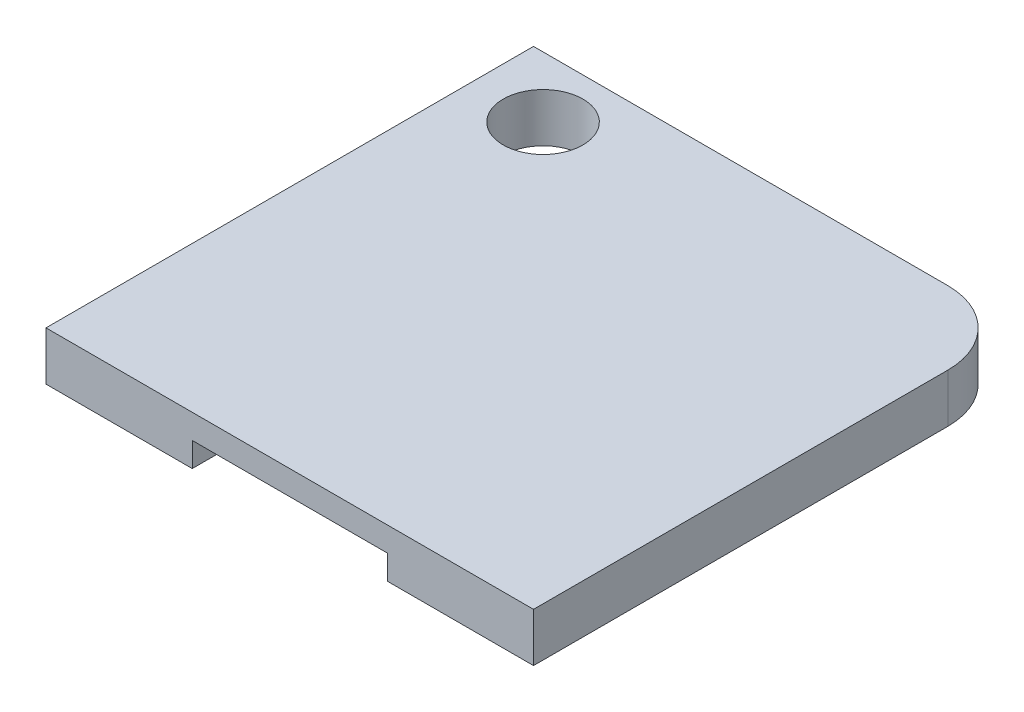
from build123d import *

# Parameters (mm, degrees)
BOSS_EXTRUDE1_DEPTH = 20
SKETCH5_R           = 16.335585921
CUT_EXTRUDE1_DEPTH  = 20
CUT_EXTRUDE2_DEPTH  = 10
SKETCH7_W           = 90
SKETCH7_H           = 3
CUT_EXTRUDE3_DEPTH  = 3
SKETCH9_W           = 110
SKETCH9_H           = 35
CUT_EXTRUDE4_DEPTH  = 8


with BuildPart() as part:
    # Sketch1 → Boss-Extrude1 (new body)
    with BuildSketch(Plane(origin=(0, 0, 0), x_dir=(1, 0, 0), z_dir=(0, 1, 0))):
        with BuildLine():
            Line((0, 0), (200, 0))
            Line((200, 0), (200, 170))
            ThreePointArc((200, 170), (191.213203436, 191.213203436), (170, 200))
            Line((170, 200), (0, 200))
            Line((0, 200), (0, 0))
        make_face()
    extrude(amount=BOSS_EXTRUDE1_DEPTH)

    # Sketch5 → Cut-Extrude1 (cut)
    with BuildSketch(Plane.XZ):
        with Locations(Location((28.826554305, -175.088684358, 0), (0, 0, 270))):
            Circle(SKETCH5_R)
    extrude(amount=-CUT_EXTRUDE1_DEPTH, mode=Mode.SUBTRACT)

    # Sketch6 → Cut-Extrude2 (cut)
    with BuildSketch(Plane(origin=(0, 0, 0), x_dir=(-1, 0, 0), z_dir=(0, -1, 0))):
        with BuildLine():
            Line((-60, 0), (-140, 0))
            Line((-140, 0), (-140, 20))
            Line((-140, 20), (-65, 20))
            ThreePointArc((-65, 20), (-61.464466094, 18.535533906), (-60, 15))
            Line((-60, 15), (-60, 0))
        make_face()
    extrude(amount=-CUT_EXTRUDE2_DEPTH, mode=Mode.SUBTRACT)

    # Sketch7 → Cut-Extrude3 (cut)
    # profile 1 of 10: a face of its own
    with BuildSketch(Plane.XZ):
        with Locations((100, -104.5)):
            Rectangle(SKETCH7_W, SKETCH7_H)
    # profile 2 of 10: a face of its own
    with BuildSketch(Plane.XZ):
        with BuildLine():
            Line((70.352564103, -92), (71.075320513, -92))
            Line((71.075320513, -92), (70.432692308, -96.59775641))
            add(Edge.make_bspline(
                [(70.432692308, -96.59775641), (70.422300824, -96.670908312), (70.402292258, -96.811760634), (70.377311776, -97.015446039), (70.354142014, -97.202276219), (70.336963803, -97.373331101), (70.321803165, -97.527624302), (70.312710928, -97.666607297), (70.305251131, -97.788915506), (70.304728318, -97.865375309), (70.304487179, -97.900641026)],
                knots=[0, 0, 0, 0, 1.353577231, 2.606282137, 3.759465843, 4.802401145, 5.755764954, 6.59944622, 7.354019609, 8, 8, 8, 8], degree=3))
            add(Edge.make_bspline(
                [(70.304487179, -97.900641026), (70.305299501, -97.962696148), (70.306873997, -98.082975525), (70.33102938, -98.257568792), (70.365092174, -98.421522608), (70.414859775, -98.574793111), (70.47967049, -98.717039292), (70.557584136, -98.849061406), (70.652362768, -98.968696914), (70.759326061, -99.077865638), (70.88024504, -99.174130519), (71.01320165, -99.257935991), (71.157185741, -99.330450263), (71.313933193, -99.387650685), (71.481762042, -99.432791589), (71.661435728, -99.464145703), (71.852661893, -99.483765472), (71.983924786, -99.486021706), (72.051282051, -99.487179487)],
                knots=[0, 0, 0, 0, 1.10852276, 2.148612763, 3.145170886, 4.099557541, 5.022755833, 5.93507125, 6.833026532, 7.744741873, 8.662042658, 9.589381315, 10.550387302, 11.538535113, 12.56716129, 13.653744098, 14.796023929, 16, 16, 16, 16], degree=3))
            add(Edge.make_bspline(
                [(72.051282051, -99.487179487), (72.145959891, -99.485326813), (72.330138076, -99.48172278), (72.597783016, -99.445074413), (72.849446414, -99.388454303), (73.084335239, -99.306509657), (73.300734302, -99.202347286), (73.499173635, -99.078396445), (73.67630564, -98.931205949), (73.833856312, -98.764212112), (73.969620277, -98.578514335), (74.087686435, -98.380316921), (74.181052375, -98.166518451), (74.226850784, -98.017586621), (74.25, -97.942307692)],
                knots=[0, 0, 0, 0, 1.169524916, 2.27509392, 3.332125827, 4.35318333, 5.342430969, 6.29492923, 7.237490507, 8.180953171, 9.125108624, 10.075132383, 11.027058416, 12, 12, 12, 12], degree=3))
            add(Edge.make_bspline(
                [(74.25, -97.942307692), (74.267958404, -97.872944619), (74.305015035, -97.729815982), (74.355679675, -97.507389154), (74.405194651, -97.271753501), (74.454021131, -97.023007981), (74.497384477, -96.760246223), (74.54345719, -96.484951509), (74.584413949, -96.196265157), (74.61022263, -95.999488792), (74.623397436, -95.899038462)],
                knots=[0, 0, 0, 0, 0.82726344, 1.707033479, 2.633662931, 3.607436325, 4.633615893, 5.708467267, 6.830219163, 8, 8, 8, 8], degree=3))
            Line((74.623397436, -95.899038462), (75.168269231, -92))
            Line((75.168269231, -92), (75.891025641, -92))
            Line((75.891025641, -92), (75.323717949, -96.0625))
            Line((75.323717949, -96.0625), (75.193910256, -97.048076923))
            add(Edge.make_bspline(
                [(75.193910256, -97.048076923), (75.175036258, -97.1588241), (75.138716049, -97.371940602), (75.071777048, -97.677863222), (75.002447084, -97.958781558), (74.927103259, -98.217090176), (74.84192865, -98.455133484), (74.744192203, -98.677018908), (74.633009808, -98.884691637), (74.510390103, -99.07855735), (74.375210994, -99.256026196), (74.233057247, -99.419200908), (74.07968723, -99.564070215), (73.916379513, -99.693610105), (73.740033448, -99.809228275), (73.545766162, -99.90781228), (73.335511238, -99.996400818), (73.107711612, -100.070969115), (72.86446258, -100.133097368), (72.605624882, -100.172117936), (72.333488822, -100.20198346), (72.146993096, -100.204061658), (72.051282051, -100.205128205)],
                knots=[0, 0, 0, 0, 1.353265375, 2.604158331, 3.771668198, 4.838683855, 5.844314426, 6.815309998, 7.756788922, 8.679786515, 9.575618763, 10.44195501, 11.284122965, 12.113306266, 12.950467805, 13.819715313, 14.734057076, 15.696656359, 16.704960335, 17.754502157, 18.847593189, 20, 20, 20, 20], degree=3))
            add(Edge.make_bspline(
                [(72.051282051, -100.205128205), (71.953996652, -100.203242158), (71.764905027, -100.199576286), (71.489986488, -100.172407932), (71.232031397, -100.126368073), (70.991329485, -100.060609601), (70.766940139, -99.977824113), (70.560133112, -99.874486221), (70.3704979, -99.752458295), (70.198200152, -99.61295711), (70.046547221, -99.456811035), (69.91192301, -99.289781127), (69.798970853, -99.108997318), (69.707965384, -98.915451891), (69.634806963, -98.710659411), (69.584106754, -98.492950061), (69.55296543, -98.263196058), (69.54972792, -98.105870545), (69.548076923, -98.025641026)],
                knots=[0, 0, 0, 0, 1.24329189, 2.416560801, 3.526769888, 4.588472701, 5.601739467, 6.578821024, 7.537115429, 8.478675995, 9.405667237, 10.314143962, 11.215899626, 12.12293848, 13.042862598, 13.990124185, 14.975046279, 16, 16, 16, 16], degree=3))
            add(Edge.make_bspline(
                [(69.548076923, -98.025641026), (69.550870082, -97.928305774), (69.556778665, -97.722405097), (69.582560065, -97.518021777), (69.596153846, -97.41025641)],
                knots=[0, 0, 0, 0, 0.945458296, 2, 2, 2, 2], degree=3))
            Line((69.596153846, -97.41025641), (69.725961538, -96.480769231))
            Line((69.725961538, -96.480769231), (70.352564103, -92))
        make_face()
    # profile 3 of 10: a face of its own
    with BuildSketch(Plane.XZ):
        Polygon((77.737179487, -92), (78.461538462, -92), (77.439102564, -99.282051282), (81.025641026, -99.282051282), (80.934294872, -100), (76.615384615, -100), align=None)
    # profile 4 of 10: a face of its own
    with BuildSketch(Plane.XZ):
        with BuildLine():
            Line((82.865384615, -92), (83.929487179, -92))
            add(Edge.make_bspline(
                [(83.929487179, -92), (84.055025405, -92.000708657), (84.294910604, -92.002062797), (84.639009488, -92.009658845), (84.95164464, -92.023558951), (85.232672248, -92.044503371), (85.481975713, -92.068871991), (85.698935751, -92.101272499), (85.885142932, -92.136307333), (86.088925422, -92.193195814), (86.311010439, -92.286550465), (86.552706109, -92.427294209), (86.763470346, -92.608233637), (86.916456138, -92.783435333), (87.021845698, -92.93718698), (87.091582726, -93.058798887), (87.151332105, -93.185535992), (87.198921769, -93.318245431), (87.235989815, -93.45606665), (87.263273272, -93.598471944), (87.279711122, -93.746405658), (87.281264314, -93.846646208), (87.282051282, -93.897435897)],
                knots=[0, 0, 0, 0, 1.713639989, 3.274515547, 4.697934289, 5.984790924, 7.121028854, 8.116168752, 8.97848632, 9.705660403, 11.000241027, 12.255790122, 13.507819356, 14.774100285, 15.41929254, 16.049687228, 16.685791521, 17.329333453, 17.971427875, 18.63213285, 19.30693169, 20, 20, 20, 20], degree=3))
            add(Edge.make_bspline(
                [(87.282051282, -93.897435897), (87.278278942, -94.003014144), (87.270875345, -94.210222057), (87.205629077, -94.511203146), (87.103209595, -94.79610043), (86.956622355, -95.058329907), (86.778888968, -95.29725475), (86.565078763, -95.498333204), (86.326812407, -95.67005185), (86.14802191, -95.749782239), (86.057692308, -95.790064103)],
                knots=[0, 0, 0, 0, 1.056823587, 2.074122444, 3.071567161, 4.080224369, 5.073740054, 6.042992575, 7.011269026, 8, 8, 8, 8], degree=3))
            add(Edge.make_bspline(
                [(86.057692308, -95.790064103), (86.108161672, -95.809193194), (86.207797745, -95.846957639), (86.351570987, -95.914196812), (86.485471649, -95.992988138), (86.612416106, -96.080220251), (86.729889022, -96.177735024), (86.840665241, -96.283656232), (86.938924717, -96.402114461), (87.032529187, -96.526263112), (87.115685576, -96.659194271), (87.187578492, -96.798730393), (87.249448228, -96.944198881), (87.298427499, -97.096137771), (87.337237738, -97.253579263), (87.363859098, -97.417051561), (87.382796165, -97.586094175), (87.384004361, -97.701334558), (87.384615385, -97.759615385)],
                knots=[0, 0, 0, 0, 1.018067996, 2.009858836, 2.989905997, 3.945980057, 4.912461175, 5.86747234, 6.832691596, 7.812272302, 8.799341279, 9.786461703, 10.771006533, 11.778091379, 12.794911589, 13.827097733, 14.901092322, 16, 16, 16, 16], degree=3))
            add(Edge.make_bspline(
                [(87.384615385, -97.759615385), (87.384052822, -97.819501763), (87.382950171, -97.936881934), (87.36358016, -98.109611089), (87.337374318, -98.276318093), (87.298812688, -98.437087792), (87.248962988, -98.590613241), (87.189681946, -98.738532035), (87.117035377, -98.87880476), (87.009344159, -99.056980004), (86.851907849, -99.260589826), (86.628424188, -99.46924286), (86.374590065, -99.640952614), (86.138615204, -99.754625748), (85.925818962, -99.827058766), (85.737291632, -99.872097457), (85.522219004, -99.911754404), (85.280545877, -99.945084318), (85.012135313, -99.970388873), (84.717047312, -99.986995916), (84.395395153, -99.998828486), (84.172020669, -99.999599727), (84.056089744, -100)],
                knots=[0, 0, 0, 0, 0.779883868, 1.52860976, 2.262135662, 2.977977196, 3.68018566, 4.363971069, 5.051959645, 5.735993014, 7.075426956, 8.390346024, 9.703181531, 11.054374518, 11.789582858, 12.628635057, 13.577470096, 14.638659539, 15.806428154, 17.08949324, 18.489452623, 20, 20, 20, 20], degree=3))
            Line((84.056089744, -100), (81.743589744, -100))
            Line((81.743589744, -100), (82.865384615, -92))
        make_face()
        with BuildLine():
            Line((83.487179487, -92.717948718), (83.100961538, -95.466346154))
            add(Edge.make_bspline(
                [(83.100961538, -95.466346154), (83.194411355, -95.472606713), (83.395032086, -95.48604706), (83.596110327, -95.486785184), (83.703525641, -95.487179487)],
                knots=[0, 0, 0, 0, 0.931606784, 2, 2, 2, 2], degree=3))
            add(Edge.make_bspline(
                [(83.703525641, -95.487179487), (83.800216501, -95.486436301), (83.986687832, -95.485003045), (84.256049573, -95.477690175), (84.504991888, -95.462677138), (84.732861529, -95.4448888), (84.939584097, -95.418460539), (85.125454783, -95.38929422), (85.290715623, -95.352408377), (85.480288454, -95.298460828), (85.690889443, -95.212669771), (85.915231556, -95.082529678), (86.111065581, -94.927604048), (86.272947093, -94.746715914), (86.403499205, -94.549375287), (86.495195544, -94.337631669), (86.555117158, -94.117074133), (86.561093386, -93.965662544), (86.564102564, -93.889423077)],
                knots=[0, 0, 0, 0, 1.258421987, 2.426905936, 3.50630935, 4.503965816, 5.400770509, 6.217970006, 6.951680648, 7.602963313, 8.781660828, 9.900119981, 10.968496616, 12.016986349, 13.046684254, 14.033527016, 15.009832386, 16, 16, 16, 16], degree=3))
            add(Edge.make_bspline(
                [(86.564102564, -93.889423077), (86.562349444, -93.840224468), (86.558960174, -93.745109833), (86.53896029, -93.60693323), (86.500539228, -93.479618965), (86.452876912, -93.359997419), (86.384647387, -93.252767149), (86.304401242, -93.154924708), (86.21068816, -93.065226876), (86.098598515, -92.986649626), (85.962429279, -92.91772939), (85.796394373, -92.859785047), (85.598148977, -92.811493273), (85.368596663, -92.770083849), (85.106375432, -92.738864792), (84.811750954, -92.71707985), (84.484078796, -92.704795712), (84.254818138, -92.702911159), (84.134615385, -92.701923077)],
                knots=[0, 0, 0, 0, 0.770982972, 1.490525127, 2.17903608, 2.850400427, 3.500570698, 4.160574778, 4.829431296, 5.525930234, 6.296867794, 7.212684737, 8.274122517, 9.490350183, 10.864547009, 12.408691128, 14.117054985, 16, 16, 16, 16], degree=3))
            add(Edge.make_bspline(
                [(84.134615385, -92.701923077), (84.088677388, -92.702554093), (83.991460452, -92.703889489), (83.837539552, -92.703944006), (83.66775697, -92.712277718), (83.549150544, -92.716002529), (83.487179487, -92.717948718)],
                knots=[0, 0, 0, 0, 0.851215263, 1.80139636, 2.851244431, 4, 4, 4, 4], degree=3))
        make_face(mode=Mode.SUBTRACT)
        with BuildLine():
            Line((82.996794872, -96.205128205), (82.567307692, -99.282051282))
            Line((82.567307692, -99.282051282), (83.719551282, -99.282051282))
            add(Edge.make_bspline(
                [(83.719551282, -99.282051282), (83.815709547, -99.281836856), (84.000560213, -99.281424652), (84.266033655, -99.275739997), (84.508676484, -99.270922733), (84.727621723, -99.258558876), (84.923314403, -99.247018308), (85.09468503, -99.230136905), (85.243218444, -99.214565605), (85.333418091, -99.197137086), (85.375, -99.189102564)],
                knots=[0, 0, 0, 0, 1.390128315, 2.672325091, 3.838879377, 4.898285343, 5.842492367, 6.672434616, 7.387994248, 8, 8, 8, 8], degree=3))
            add(Edge.make_bspline(
                [(85.375, -99.189102564), (85.426430407, -99.176841875), (85.527345197, -99.152784417), (85.672471772, -99.108129946), (85.808768755, -99.056842224), (85.934075505, -98.997419911), (86.051870603, -98.933960678), (86.15646378, -98.859229599), (86.254382889, -98.781046663), (86.340529962, -98.693815334), (86.418776034, -98.6009956), (86.48359532, -98.49936682), (86.54043714, -98.392961548), (86.587308264, -98.280472572), (86.622463084, -98.160518911), (86.647452703, -98.034459328), (86.664526303, -97.902171464), (86.665943563, -97.812021341), (86.666666667, -97.766025641)],
                knots=[0, 0, 0, 0, 1.20370812, 2.361870334, 3.455300794, 4.51645333, 5.518362628, 6.49696157, 7.439279167, 8.368233244, 9.284032758, 10.198376952, 11.107120831, 12.028798916, 12.967891947, 13.94837913, 14.953237829, 16, 16, 16, 16], degree=3))
            add(Edge.make_bspline(
                [(86.666666667, -97.766025641), (86.663875592, -97.685111287), (86.658457882, -97.528049767), (86.608529202, -97.303245138), (86.523439647, -97.100100436), (86.425592301, -96.947956032), (86.328356201, -96.839552846), (86.247257064, -96.759386257), (86.151202684, -96.689468431), (86.048947435, -96.618106647), (85.932424487, -96.557632962), (85.807465493, -96.497285638), (85.670731012, -96.443266535), (85.522123397, -96.393271263), (85.359189391, -96.347801165), (85.178598485, -96.310350423), (84.979976954, -96.275850948), (84.761511713, -96.251720203), (84.524803933, -96.231055701), (84.269445802, -96.214263298), (83.99523003, -96.207427822), (83.806091154, -96.205911782), (83.708333333, -96.205128205)],
                knots=[0, 0, 0, 0, 1.286382193, 2.496975268, 3.639964159, 4.776391108, 5.354547871, 5.955741874, 6.586497162, 7.241915707, 7.937968511, 8.671820299, 9.450019386, 10.275265476, 11.166193925, 12.139859272, 13.208926099, 14.372962585, 15.635875714, 16.990120464, 18.444321603, 20, 20, 20, 20], degree=3))
            Line((83.708333333, -96.205128205), (82.996794872, -96.205128205))
        make_face(mode=Mode.SUBTRACT)
    # profile 5 of 10: a face of its own
    with BuildSketch(Plane.XZ):
        Polygon((96, -92), (95.90224359, -92.717948718), (92.923076923, -92.717948718), (92.548076923, -95.384615385), (95.487179487, -95.384615385), (95.389423077, -96.102564103), (92.448717949, -96.102564103), (91.90224359, -100), (91.179487179, -100), (92.301282051, -92), align=None)
    # profile 6 of 10: a face of its own
    with BuildSketch(Plane.XZ):
        Polygon((100.913461538, -92), (103.615384615, -100), (102.863782051, -100), (101.961538462, -97.333333333), (98.440705128, -97.333333333), (96.891025641, -100), (96.076923077, -100), (100.729166667, -92), align=None)
        Polygon((100.666666667, -93.501602564), (98.857371795, -96.615384615), (101.717948718, -96.615384615), align=None, mode=Mode.SUBTRACT)
    # profile 7 of 10: a face of its own
    with BuildSketch(Plane.XZ):
        with BuildLine():
            Line((105.83974359, -92), (106.903846154, -92))
            add(Edge.make_bspline(
                [(106.903846154, -92), (107.029384379, -92.000708657), (107.269269578, -92.002062797), (107.613368462, -92.009658845), (107.926003614, -92.023558951), (108.207031223, -92.044503371), (108.456334687, -92.068871991), (108.673294725, -92.101272499), (108.859501906, -92.136307333), (109.063284397, -92.193195814), (109.285369413, -92.286550465), (109.527065083, -92.427294209), (109.737829321, -92.608233637), (109.890815112, -92.783435333), (109.996204672, -92.93718698), (110.0659417, -93.058798887), (110.12569108, -93.185535992), (110.173280743, -93.318245431), (110.210348789, -93.45606665), (110.237632247, -93.598471944), (110.254070096, -93.746405658), (110.255623288, -93.846646208), (110.256410256, -93.897435897)],
                knots=[0, 0, 0, 0, 1.713639989, 3.274515547, 4.697934289, 5.984790924, 7.121028854, 8.116168752, 8.97848632, 9.705660403, 11.000241027, 12.255790122, 13.507819356, 14.774100285, 15.41929254, 16.049687228, 16.685791521, 17.329333453, 17.971427875, 18.63213285, 19.30693169, 20, 20, 20, 20], degree=3))
            add(Edge.make_bspline(
                [(110.256410256, -93.897435897), (110.252637916, -94.003014144), (110.24523432, -94.210222057), (110.179988052, -94.511203146), (110.077568569, -94.79610043), (109.930981329, -95.058329907), (109.753247942, -95.29725475), (109.539437738, -95.498333204), (109.301171382, -95.67005185), (109.122380884, -95.749782239), (109.032051282, -95.790064103)],
                knots=[0, 0, 0, 0, 1.056823587, 2.074122444, 3.071567161, 4.080224369, 5.073740054, 6.042992575, 7.011269026, 8, 8, 8, 8], degree=3))
            add(Edge.make_bspline(
                [(109.032051282, -95.790064103), (109.082520646, -95.809193194), (109.182156719, -95.846957639), (109.325929961, -95.914196812), (109.459830624, -95.992988138), (109.586775081, -96.080220251), (109.704247997, -96.177735024), (109.815024215, -96.283656232), (109.913283692, -96.402114461), (110.006888161, -96.526263112), (110.090044551, -96.659194271), (110.161937466, -96.798730393), (110.223807202, -96.944198881), (110.272786473, -97.096137771), (110.311596712, -97.253579263), (110.338218072, -97.417051561), (110.35715514, -97.586094175), (110.358363335, -97.701334558), (110.358974359, -97.759615385)],
                knots=[0, 0, 0, 0, 1.018067996, 2.009858836, 2.989905997, 3.945980057, 4.912461175, 5.86747234, 6.832691596, 7.812272302, 8.799341279, 9.786461703, 10.771006533, 11.778091379, 12.794911589, 13.827097733, 14.901092322, 16, 16, 16, 16], degree=3))
            add(Edge.make_bspline(
                [(110.358974359, -97.759615385), (110.358411796, -97.819501763), (110.357309146, -97.936881934), (110.337939134, -98.109611089), (110.311733292, -98.276318093), (110.273171662, -98.437087792), (110.223321962, -98.590613241), (110.16404092, -98.738532035), (110.091394351, -98.87880476), (109.983703133, -99.056980004), (109.826266823, -99.260589826), (109.602783162, -99.46924286), (109.348949039, -99.640952614), (109.112974179, -99.754625748), (108.900177936, -99.827058766), (108.711650606, -99.872097457), (108.496577978, -99.911754404), (108.254904852, -99.945084318), (107.986494287, -99.970388873), (107.691406287, -99.986995916), (107.369754128, -99.998828486), (107.146379643, -99.999599727), (107.030448718, -100)],
                knots=[0, 0, 0, 0, 0.779883868, 1.52860976, 2.262135662, 2.977977196, 3.68018566, 4.363971069, 5.051959645, 5.735993014, 7.075426956, 8.390346024, 9.703181531, 11.054374518, 11.789582858, 12.628635057, 13.577470096, 14.638659539, 15.806428154, 17.08949324, 18.489452623, 20, 20, 20, 20], degree=3))
            Line((107.030448718, -100), (104.717948718, -100))
            Line((104.717948718, -100), (105.83974359, -92))
        make_face()
        with BuildLine():
            Line((106.461538462, -92.717948718), (106.075320513, -95.466346154))
            add(Edge.make_bspline(
                [(106.075320513, -95.466346154), (106.16877033, -95.472606713), (106.369391061, -95.48604706), (106.570469301, -95.486785184), (106.677884615, -95.487179487)],
                knots=[0, 0, 0, 0, 0.931606784, 2, 2, 2, 2], degree=3))
            add(Edge.make_bspline(
                [(106.677884615, -95.487179487), (106.774575476, -95.486436301), (106.961046806, -95.485003045), (107.230408547, -95.477690175), (107.479350862, -95.462677138), (107.707220503, -95.4448888), (107.913943071, -95.418460539), (108.099813757, -95.38929422), (108.265074597, -95.352408377), (108.454647428, -95.298460828), (108.665248417, -95.212669771), (108.889590531, -95.082529678), (109.085424556, -94.927604048), (109.247306067, -94.746715914), (109.37785818, -94.549375287), (109.469554518, -94.337631669), (109.529476132, -94.117074133), (109.53545236, -93.965662544), (109.538461538, -93.889423077)],
                knots=[0, 0, 0, 0, 1.258421987, 2.426905936, 3.50630935, 4.503965816, 5.400770509, 6.217970006, 6.951680648, 7.602963313, 8.781660828, 9.900119981, 10.968496616, 12.016986349, 13.046684254, 14.033527016, 15.009832386, 16, 16, 16, 16], degree=3))
            add(Edge.make_bspline(
                [(109.538461538, -93.889423077), (109.536708418, -93.840224468), (109.533319148, -93.745109833), (109.513319264, -93.60693323), (109.474898203, -93.479618965), (109.427235886, -93.359997419), (109.359006362, -93.252767149), (109.278760216, -93.154924708), (109.185047134, -93.065226876), (109.072957489, -92.986649626), (108.936788254, -92.91772939), (108.770753347, -92.859785047), (108.572507952, -92.811493273), (108.342955638, -92.770083849), (108.080734406, -92.738864792), (107.786109928, -92.71707985), (107.45843777, -92.704795712), (107.229177112, -92.702911159), (107.108974359, -92.701923077)],
                knots=[0, 0, 0, 0, 0.770982972, 1.490525127, 2.17903608, 2.850400427, 3.500570698, 4.160574778, 4.829431296, 5.525930234, 6.296867794, 7.212684737, 8.274122517, 9.490350183, 10.864547009, 12.408691128, 14.117054985, 16, 16, 16, 16], degree=3))
            add(Edge.make_bspline(
                [(107.108974359, -92.701923077), (107.063036363, -92.702554093), (106.965819427, -92.703889489), (106.811898527, -92.703944006), (106.642115945, -92.712277718), (106.523509519, -92.716002529), (106.461538462, -92.717948718)],
                knots=[0, 0, 0, 0, 0.851215263, 1.80139636, 2.851244431, 4, 4, 4, 4], degree=3))
        make_face(mode=Mode.SUBTRACT)
        with BuildLine():
            Line((105.971153846, -96.205128205), (105.541666667, -99.282051282))
            Line((105.541666667, -99.282051282), (106.693910256, -99.282051282))
            add(Edge.make_bspline(
                [(106.693910256, -99.282051282), (106.790068522, -99.281836856), (106.974919188, -99.281424652), (107.240392629, -99.275739997), (107.483035458, -99.270922733), (107.701980698, -99.258558876), (107.897673378, -99.247018308), (108.069044005, -99.230136905), (108.217577418, -99.214565605), (108.307777065, -99.197137086), (108.349358974, -99.189102564)],
                knots=[0, 0, 0, 0, 1.390128315, 2.672325091, 3.838879377, 4.898285343, 5.842492367, 6.672434616, 7.387994248, 8, 8, 8, 8], degree=3))
            add(Edge.make_bspline(
                [(108.349358974, -99.189102564), (108.400789381, -99.176841875), (108.501704171, -99.152784417), (108.646830747, -99.108129946), (108.78312773, -99.056842224), (108.908434479, -98.997419911), (109.026229577, -98.933960678), (109.130822754, -98.859229599), (109.228741864, -98.781046663), (109.314888936, -98.693815334), (109.393135008, -98.6009956), (109.457954294, -98.49936682), (109.514796114, -98.392961548), (109.561667238, -98.280472572), (109.596822059, -98.160518911), (109.621811678, -98.034459328), (109.638885277, -97.902171464), (109.640302537, -97.812021341), (109.641025641, -97.766025641)],
                knots=[0, 0, 0, 0, 1.20370812, 2.361870334, 3.455300794, 4.51645333, 5.518362628, 6.49696157, 7.439279167, 8.368233244, 9.284032758, 10.198376952, 11.107120831, 12.028798916, 12.967891947, 13.94837913, 14.953237829, 16, 16, 16, 16], degree=3))
            add(Edge.make_bspline(
                [(109.641025641, -97.766025641), (109.638234566, -97.685111287), (109.632816857, -97.528049767), (109.582888177, -97.303245138), (109.497798622, -97.100100436), (109.399951275, -96.947956032), (109.302715175, -96.839552846), (109.221616039, -96.759386257), (109.125561658, -96.689468431), (109.02330641, -96.618106647), (108.906783462, -96.557632962), (108.781824467, -96.497285638), (108.645089986, -96.443266535), (108.496482371, -96.393271263), (108.333548365, -96.347801165), (108.15295746, -96.310350423), (107.954335928, -96.275850948), (107.735870687, -96.251720203), (107.499162907, -96.231055701), (107.243804777, -96.214263298), (106.969589005, -96.207427822), (106.780450128, -96.205911782), (106.682692308, -96.205128205)],
                knots=[0, 0, 0, 0, 1.286382193, 2.496975268, 3.639964159, 4.776391108, 5.354547871, 5.955741874, 6.586497162, 7.241915707, 7.937968511, 8.671820299, 9.450019386, 10.275265476, 11.166193925, 12.139859272, 13.208926099, 14.372962585, 15.635875714, 16.990120464, 18.444321603, 20, 20, 20, 20], degree=3))
            Line((106.682692308, -96.205128205), (105.971153846, -96.205128205))
        make_face(mode=Mode.SUBTRACT)
    # profile 8 of 10: a face of its own
    with BuildSketch(Plane.XZ):
        Polygon((112.198717949, -92), (112.923076923, -92), (111.900641026, -99.282051282), (115.487179487, -99.282051282), (115.395833333, -100), (111.076923077, -100), align=None)
    # profile 9 of 10: a face of its own
    with BuildSketch(Plane.XZ):
        Polygon((120.605769231, -92), (123.307692308, -100), (122.556089744, -100), (121.653846154, -97.333333333), (118.133012821, -97.333333333), (116.583333333, -100), (115.769230769, -100), (120.421474359, -92), align=None)
        Polygon((120.358974359, -93.501602564), (118.549679487, -96.615384615), (121.41025641, -96.615384615), align=None, mode=Mode.SUBTRACT)
    # profile 10 of 10: a face of its own
    with BuildSketch(Plane.XZ):
        with BuildLine():
            Line((125.532051282, -92), (126.596153846, -92))
            add(Edge.make_bspline(
                [(126.596153846, -92), (126.721692071, -92.000708657), (126.96157727, -92.002062797), (127.305676155, -92.009658845), (127.618311307, -92.023558951), (127.899338915, -92.044503371), (128.148642379, -92.068871991), (128.365602418, -92.101272499), (128.551809598, -92.136307333), (128.755592089, -92.193195814), (128.977677106, -92.286550465), (129.219372776, -92.427294209), (129.430137013, -92.608233637), (129.583122804, -92.783435333), (129.688512365, -92.93718698), (129.758249392, -93.058798887), (129.817998772, -93.185535992), (129.865588436, -93.318245431), (129.902656481, -93.45606665), (129.929939939, -93.598471944), (129.946377789, -93.746405658), (129.94793098, -93.846646208), (129.948717949, -93.897435897)],
                knots=[0, 0, 0, 0, 1.713639989, 3.274515547, 4.697934289, 5.984790924, 7.121028854, 8.116168752, 8.97848632, 9.705660403, 11.000241027, 12.255790122, 13.507819356, 14.774100285, 15.41929254, 16.049687228, 16.685791521, 17.329333453, 17.971427875, 18.63213285, 19.30693169, 20, 20, 20, 20], degree=3))
            add(Edge.make_bspline(
                [(129.948717949, -93.897435897), (129.944945609, -94.003014144), (129.937542012, -94.210222057), (129.872295744, -94.511203146), (129.769876262, -94.79610043), (129.623289021, -95.058329907), (129.445555635, -95.29725475), (129.23174543, -95.498333204), (128.993479074, -95.67005185), (128.814688577, -95.749782239), (128.724358974, -95.790064103)],
                knots=[0, 0, 0, 0, 1.056823587, 2.074122444, 3.071567161, 4.080224369, 5.073740054, 6.042992575, 7.011269026, 8, 8, 8, 8], degree=3))
            add(Edge.make_bspline(
                [(128.724358974, -95.790064103), (128.774828338, -95.809193194), (128.874464412, -95.846957639), (129.018237654, -95.914196812), (129.152138316, -95.992988138), (129.279082773, -96.080220251), (129.396555689, -96.177735024), (129.507331908, -96.283656232), (129.605591384, -96.402114461), (129.699195854, -96.526263112), (129.782352243, -96.659194271), (129.854245158, -96.798730393), (129.916114894, -96.944198881), (129.965094165, -97.096137771), (130.003904404, -97.253579263), (130.030525765, -97.417051561), (130.049462832, -97.586094175), (130.050671027, -97.701334558), (130.051282051, -97.759615385)],
                knots=[0, 0, 0, 0, 1.018067996, 2.009858836, 2.989905997, 3.945980057, 4.912461175, 5.86747234, 6.832691596, 7.812272302, 8.799341279, 9.786461703, 10.771006533, 11.778091379, 12.794911589, 13.827097733, 14.901092322, 16, 16, 16, 16], degree=3))
            add(Edge.make_bspline(
                [(130.051282051, -97.759615385), (130.050719488, -97.819501763), (130.049616838, -97.936881934), (130.030246827, -98.109611089), (130.004040985, -98.276318093), (129.965479354, -98.437087792), (129.915629654, -98.590613241), (129.856348612, -98.738532035), (129.783702043, -98.87880476), (129.676010825, -99.056980004), (129.518574516, -99.260589826), (129.295090855, -99.46924286), (129.041256731, -99.640952614), (128.805281871, -99.754625748), (128.592485629, -99.827058766), (128.403958299, -99.872097457), (128.188885671, -99.911754404), (127.947212544, -99.945084318), (127.678801979, -99.970388873), (127.383713979, -99.986995916), (127.06206182, -99.998828486), (126.838687336, -99.999599727), (126.72275641, -100)],
                knots=[0, 0, 0, 0, 0.779883868, 1.52860976, 2.262135662, 2.977977196, 3.68018566, 4.363971069, 5.051959645, 5.735993014, 7.075426956, 8.390346024, 9.703181531, 11.054374518, 11.789582858, 12.628635057, 13.577470096, 14.638659539, 15.806428154, 17.08949324, 18.489452623, 20, 20, 20, 20], degree=3))
            Line((126.72275641, -100), (124.41025641, -100))
            Line((124.41025641, -100), (125.532051282, -92))
        make_face()
        with BuildLine():
            Line((126.153846154, -92.717948718), (125.767628205, -95.466346154))
            add(Edge.make_bspline(
                [(125.767628205, -95.466346154), (125.861078022, -95.472606713), (126.061698753, -95.48604706), (126.262776994, -95.486785184), (126.370192308, -95.487179487)],
                knots=[0, 0, 0, 0, 0.931606784, 2, 2, 2, 2], degree=3))
            add(Edge.make_bspline(
                [(126.370192308, -95.487179487), (126.466883168, -95.486436301), (126.653354499, -95.485003045), (126.92271624, -95.477690175), (127.171658554, -95.462677138), (127.399528196, -95.4448888), (127.606250763, -95.418460539), (127.792121449, -95.38929422), (127.957382289, -95.352408377), (128.146955121, -95.298460828), (128.357556109, -95.212669771), (128.581898223, -95.082529678), (128.777732248, -94.927604048), (128.939613759, -94.746715914), (129.070165872, -94.549375287), (129.161862211, -94.337631669), (129.221783825, -94.117074133), (129.227760053, -93.965662544), (129.230769231, -93.889423077)],
                knots=[0, 0, 0, 0, 1.258421987, 2.426905936, 3.50630935, 4.503965816, 5.400770509, 6.217970006, 6.951680648, 7.602963313, 8.781660828, 9.900119981, 10.968496616, 12.016986349, 13.046684254, 14.033527016, 15.009832386, 16, 16, 16, 16], degree=3))
            add(Edge.make_bspline(
                [(129.230769231, -93.889423077), (129.229016111, -93.840224468), (129.22562684, -93.745109833), (129.205626956, -93.60693323), (129.167205895, -93.479618965), (129.119543579, -93.359997419), (129.051314054, -93.252767149), (128.971067909, -93.154924708), (128.877354826, -93.065226876), (128.765265181, -92.986649626), (128.629095946, -92.91772939), (128.46306104, -92.859785047), (128.264815644, -92.811493273), (128.03526333, -92.770083849), (127.773042098, -92.738864792), (127.47841762, -92.71707985), (127.150745463, -92.704795712), (126.921484804, -92.702911159), (126.801282051, -92.701923077)],
                knots=[0, 0, 0, 0, 0.770982972, 1.490525127, 2.17903608, 2.850400427, 3.500570698, 4.160574778, 4.829431296, 5.525930234, 6.296867794, 7.212684737, 8.274122517, 9.490350183, 10.864547009, 12.408691128, 14.117054985, 16, 16, 16, 16], degree=3))
            add(Edge.make_bspline(
                [(126.801282051, -92.701923077), (126.755344055, -92.702554093), (126.658127119, -92.703889489), (126.504206219, -92.703944006), (126.334423637, -92.712277718), (126.215817211, -92.716002529), (126.153846154, -92.717948718)],
                knots=[0, 0, 0, 0, 0.851215263, 1.80139636, 2.851244431, 4, 4, 4, 4], degree=3))
        make_face(mode=Mode.SUBTRACT)
        with BuildLine():
            Line((125.663461538, -96.205128205), (125.233974359, -99.282051282))
            Line((125.233974359, -99.282051282), (126.386217949, -99.282051282))
            add(Edge.make_bspline(
                [(126.386217949, -99.282051282), (126.482376214, -99.281836856), (126.66722688, -99.281424652), (126.932700321, -99.275739997), (127.17534315, -99.270922733), (127.39428839, -99.258558876), (127.58998107, -99.247018308), (127.761351697, -99.230136905), (127.909885111, -99.214565605), (128.000084758, -99.197137086), (128.041666667, -99.189102564)],
                knots=[0, 0, 0, 0, 1.390128315, 2.672325091, 3.838879377, 4.898285343, 5.842492367, 6.672434616, 7.387994248, 8, 8, 8, 8], degree=3))
            add(Edge.make_bspline(
                [(128.041666667, -99.189102564), (128.093097073, -99.176841875), (128.194011863, -99.152784417), (128.339138439, -99.108129946), (128.475435422, -99.056842224), (128.600742172, -98.997419911), (128.71853727, -98.933960678), (128.823130447, -98.859229599), (128.921049556, -98.781046663), (129.007196629, -98.693815334), (129.0854427, -98.6009956), (129.150261986, -98.49936682), (129.207103806, -98.392961548), (129.25397493, -98.280472572), (129.289129751, -98.160518911), (129.31411937, -98.034459328), (129.33119297, -97.902171464), (129.33261023, -97.812021341), (129.333333333, -97.766025641)],
                knots=[0, 0, 0, 0, 1.20370812, 2.361870334, 3.455300794, 4.51645333, 5.518362628, 6.49696157, 7.439279167, 8.368233244, 9.284032758, 10.198376952, 11.107120831, 12.028798916, 12.967891947, 13.94837913, 14.953237829, 16, 16, 16, 16], degree=3))
            add(Edge.make_bspline(
                [(129.333333333, -97.766025641), (129.330542258, -97.685111287), (129.325124549, -97.528049767), (129.275195869, -97.303245138), (129.190106314, -97.100100436), (129.092258967, -96.947956032), (128.995022867, -96.839552846), (128.913923731, -96.759386257), (128.817869351, -96.689468431), (128.715614102, -96.618106647), (128.599091154, -96.557632962), (128.474132159, -96.497285638), (128.337397679, -96.443266535), (128.188790064, -96.393271263), (128.025856058, -96.347801165), (127.845265152, -96.310350423), (127.646643621, -96.275850948), (127.42817838, -96.251720203), (127.1914706, -96.231055701), (126.936112469, -96.214263298), (126.661896697, -96.207427822), (126.472757821, -96.205911782), (126.375, -96.205128205)],
                knots=[0, 0, 0, 0, 1.286382193, 2.496975268, 3.639964159, 4.776391108, 5.354547871, 5.955741874, 6.586497162, 7.241915707, 7.937968511, 8.671820299, 9.450019386, 10.275265476, 11.166193925, 12.139859272, 13.208926099, 14.372962585, 15.635875714, 16.990120464, 18.444321603, 20, 20, 20, 20], degree=3))
            Line((126.375, -96.205128205), (125.663461538, -96.205128205))
        make_face(mode=Mode.SUBTRACT)
    extrude(amount=-CUT_EXTRUDE3_DEPTH, mode=Mode.SUBTRACT)

    # Sketch9 → Cut-Extrude4 (cut)
    with BuildSketch(Plane(origin=(0, 0, 0), x_dir=(-1, 0, 0), z_dir=(0, -1, 0))):
        with Locations((-100, 137.5)):
            Rectangle(SKETCH9_W, SKETCH9_H)
    extrude(amount=-CUT_EXTRUDE4_DEPTH, mode=Mode.SUBTRACT)


solid = part.part
